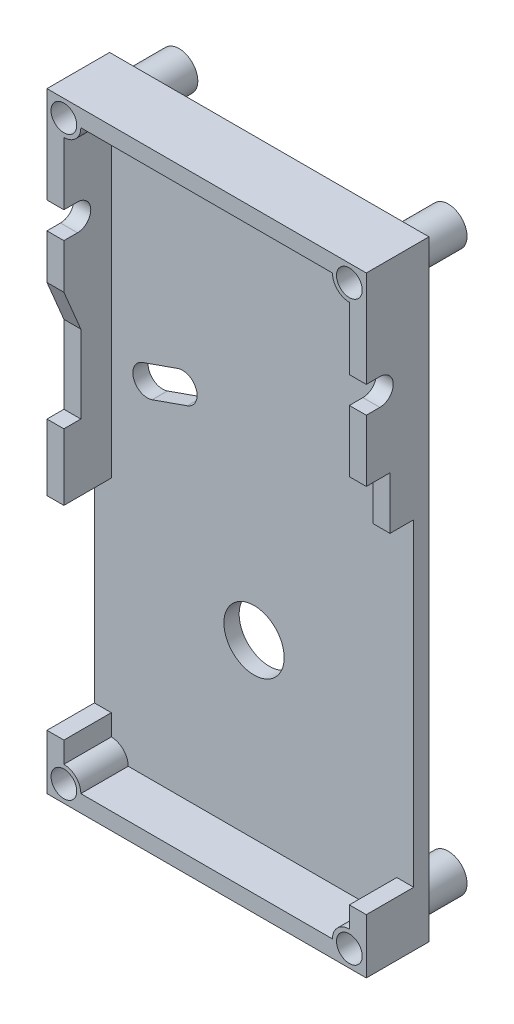
from build123d import *
from build123d.topology import SkipClean

# Parameters (mm, degrees)
SKETCH2_W           = 23.9522
SKETCH2_H           = 45.7962
SKETCH2_R           = 2.2606
BOSS_EXTRUDE1_DEPTH = 4.699
SKETCH4_W           = 21.4122
SKETCH4_H           = 43.2562
CUT_EXTRUDE1_DEPTH  = 3.556
SKETCH5_R           = 1.4097
BOSS_EXTRUDE2_DEPTH = 3.3274
SKETCH6_W           = 3.556
SKETCH6_H           = 15.24
CUT_EXTRUDE3_DEPTH  = 2.54
CUT_EXTRUDE4_DEPTH  = 34.468066413
CUT_EXTRUDE5_DEPTH  = 2.54
BOSS_EXTRUDE3_DEPTH = 3.556
CUT_EXTRUDE6_START  = -3.81
SKETCH12_R          = 0.9652
CUT_EXTRUDE6_DEPTH  = 3.81


with BuildPart() as part:
    # Sketch2 → Boss-Extrude1 (new body)
    with BuildSketch(Plane.XY):
        Rectangle(SKETCH2_W, SKETCH2_H)
        with Locations((0, -8.7249)):
            Circle(SKETCH2_R, mode=Mode.SUBTRACT)
        with BuildLine():
            Line((-8.361518313, 5.139100055), (-5.725634689, 6.065681687))
            ThreePointArc((-5.725634689, 6.065681687), (-4.333034634, 5.3975), (-5.001216321, 4.004899945))
            Line((-5.001216321, 4.004899945), (-7.637099945, 3.078318313))
            ThreePointArc((-7.637099945, 3.078318313), (-9.0297, 3.7465), (-8.361518313, 5.139100055))
        make_face(mode=Mode.SUBTRACT)
    extrude(amount=BOSS_EXTRUDE1_DEPTH)

    # Sketch4 → Cut-Extrude1 (cut)
    with BuildSketch(Plane.XY.offset(4.699)):
        Rectangle(SKETCH4_W, SKETCH4_H)
    extrude(amount=-CUT_EXTRUDE1_DEPTH, mode=Mode.SUBTRACT)

    # Sketch5 → Boss-Extrude2 (add)
    with BuildSketch(Plane(origin=(0, 0, 0), x_dir=(-1, 0, 0), z_dir=(0, 0, -1))):
        with Locations((-10.0965, 21.0185)):
            Circle(SKETCH5_R)
        with Locations(Location((10.0965, 21.0185, 0), (0, 0, 180))):
            Circle(SKETCH5_R)
        with Locations((10.0965, -21.0185)):
            Circle(SKETCH5_R)
        with Locations(Location((-10.0965, -21.0185, 0), (0, 0, 180))):
            Circle(SKETCH5_R)
    extrude(amount=BOSS_EXTRUDE2_DEPTH)

    # Sketch6 → Cut-Extrude3 (cut)
    with BuildSketch(Plane.ZY.offset(11.9761)):
        with Locations((2.921, -11.1633)):
            Rectangle(SKETCH6_W, SKETCH6_H)
        Polygon((4.699, 1.4351), (3.429, 1.4351), (3.429, 7.2771), (4.699, 10.306154579), align=None)
    extrude(amount=-CUT_EXTRUDE3_DEPTH, mode=Mode.SUBTRACT)

    # Sketch6<5> → Cut-Extrude4 (cut, through all)
    with BuildSketch(Plane.ZY.offset(11.9761)):
        with BuildLine():
            Line((3.683, 13.658954579), (4.699, 13.658954579))
            Line((4.699, 13.658954579), (4.699, 15.658954579))
            Line((4.699, 15.658954579), (3.683, 15.658954579))
            ThreePointArc((3.683, 15.658954579), (2.683, 14.658954579), (3.683, 13.658954579))
        make_face()
    extrude(amount=-CUT_EXTRUDE4_DEPTH, mode=Mode.SUBTRACT)

    # Sketch8 → Cut-Extrude5 (cut)
    with BuildSketch(Plane(origin=(11.9761, 0, 0), x_dir=(0, 0, -1), z_dir=(1, 0, 0))):
        Polygon((-4.699, -18.7833), (-1.143, -18.7833), (-1.143, 5.0927), (-2.921, 5.0927), (-2.921, 9.0297), (-4.699, 9.0297), align=None)
    extrude(amount=-CUT_EXTRUDE5_DEPTH, mode=Mode.SUBTRACT)

    # Sketch10 → Boss-Extrude3 (add)
    with BuildSketch(Plane.XY.offset(1.143)):
        with BuildLine():
            Line((-10.7061, 20.6629), (-10.7061, 20.3581))
            ThreePointArc((-10.7061, 20.3581), (-9.808074388, 20.730074388), (-9.4361, 21.6281))
            Line((-9.4361, 21.6281), (-9.7409, 21.6281))
            ThreePointArc((-9.7409, 21.6281), (-10.023600535, 20.945600535), (-10.7061, 20.6629))
        make_face()
        with BuildLine():
            ThreePointArc((9.4361, 21.6281), (9.808074388, 20.730074388), (10.7061, 20.3581))
            Line((10.7061, 20.3581), (10.7061, 20.6629))
            ThreePointArc((10.7061, 20.6629), (10.023600535, 20.945600535), (9.7409, 21.6281))
            Line((9.7409, 21.6281), (9.4361, 21.6281))
        make_face()
        with BuildLine():
            ThreePointArc((-9.4361, -21.6281), (-9.808074388, -20.730074388), (-10.7061, -20.3581))
            Line((-10.7061, -20.3581), (-10.7061, -20.6629))
            ThreePointArc((-10.7061, -20.6629), (-10.023600535, -20.945600535), (-9.7409, -21.6281))
            Line((-9.7409, -21.6281), (-9.4361, -21.6281))
        make_face()
        with BuildLine():
            Line((9.4361, -21.6281), (9.7409, -21.6281))
            ThreePointArc((9.7409, -21.6281), (10.023600535, -20.945600535), (10.7061, -20.6629))
            Line((10.7061, -20.6629), (10.7061, -20.3581))
            ThreePointArc((10.7061, -20.3581), (9.808074388, -20.730074388), (9.4361, -21.6281))
        make_face()
    extrude(amount=BOSS_EXTRUDE3_DEPTH)

    # Sketch12 → Cut-Extrude6 (cut)
    with SkipClean():  # the faces are left unmerged after this step: merging them gives an invalid solid
        with BuildSketch(Plane.XY.offset(4.699).offset(CUT_EXTRUDE6_START)):
            with Locations(Location((-10.7061, 21.6281, 0), (0, 0, 180))):
                Circle(SKETCH12_R)
            with Locations(Location((10.7061, 21.6281, 0), (0, 0, 180))):
                Circle(SKETCH12_R)
            with Locations(Location((10.7061, -21.6281, 0), (0, 0, 180))):
                Circle(SKETCH12_R)
            with Locations(Location((-10.7061, -21.6281, 0), (0, 0, 180))):
                Circle(SKETCH12_R)
        extrude(amount=CUT_EXTRUDE6_DEPTH, mode=Mode.SUBTRACT)


solid = part.part
